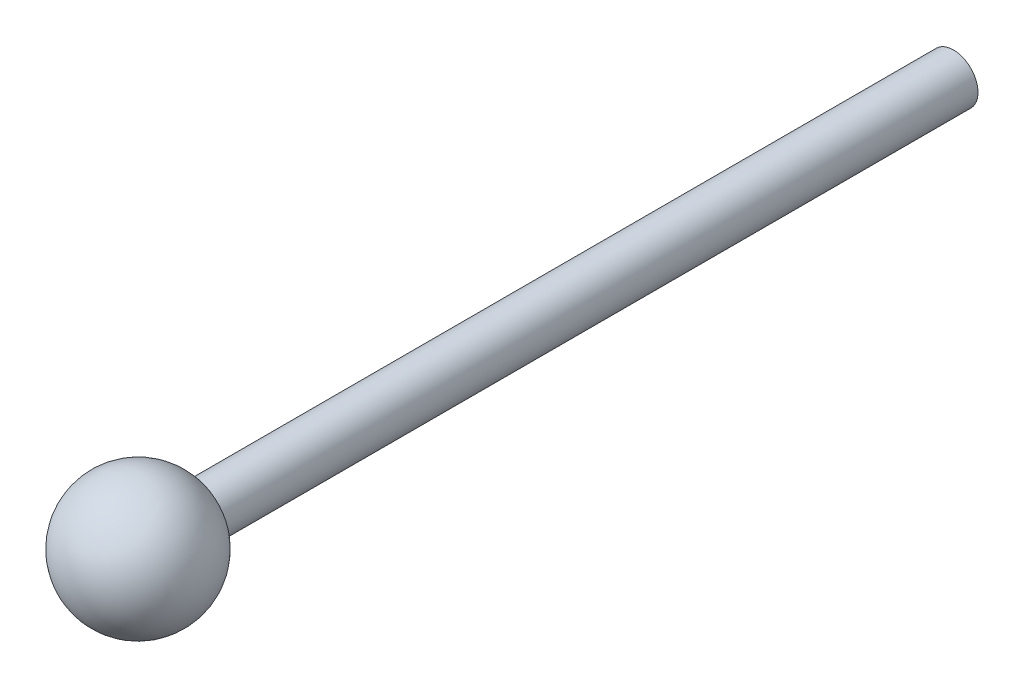
from build123d import *

# Parameters (mm, degrees)
SKETCH1_R          = 7.5
BASE_EXTRUDE_DEPTH = 250


with BuildPart() as part:
    # Sketch1 → Base-Extrude (new body)
    with BuildSketch(Plane.XY):
        Circle(SKETCH1_R)
    extrude(amount=-BASE_EXTRUDE_DEPTH)

    # Sketch5 → Boss-Revolve1 (revolve)
    with BuildSketch(Plane.XY):
        with BuildLine():
            Line((0, 20), (0, -20))
            ThreePointArc((0, -20), (20, 0), (0, 20))
        make_face()
    revolve(axis=Axis((0, 20, 0), (0, -1, 0)))


solid = part.part
